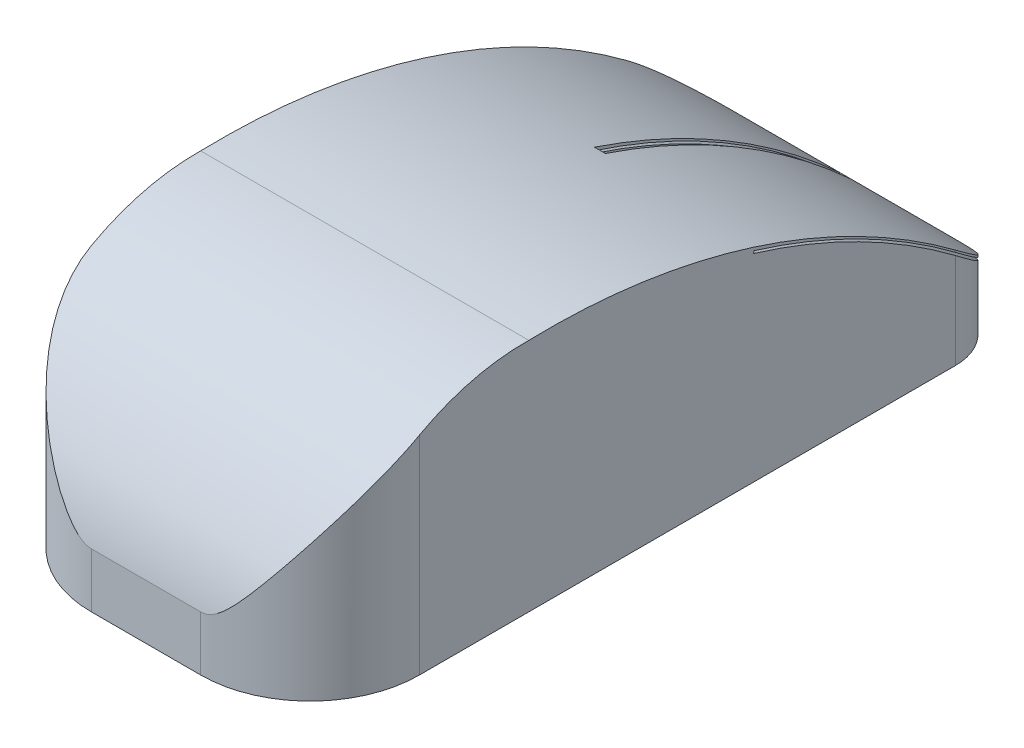
from build123d import *

# Parameters (mm, degrees)
BOSS_EXTRUDE1_DEPTH          = 10
BOSS_EXTRUDE2_DEPTH          = 60
SKETCH1_2_OUTSIDE_W          = 91.554
SKETCH1_2_OUTSIDE_H          = 159.554
CUT_EXTRUDE1_DEPTH           = 60
CUT_EXTRUDE_THIN1_DEPTH      = 148.772850252
CUT_EXTRUDE_THIN1_DEPTH_BACK = 60
SKETCH5_W                    = 2
SKETCH5_H                    = 33
CUT_EXTRUDE2_DEPTH           = 45


with BuildPart() as part:
    # Sketch1 → Boss-Extrude1 (new body)
    with BuildSketch(Plane(origin=(0, 0, 0), x_dir=(1, 0, 0), z_dir=(0, 1, 0))):
        with BuildLine():
            Line((0, 20), (0, 118))
            ThreePointArc((0, 118), (2.928932188, 125.071067812), (10, 128))
            Line((10, 128), (50, 128))
            ThreePointArc((50, 128), (57.071067812, 125.071067812), (60, 118))
            Line((60, 118), (60, 20))
            ThreePointArc((60, 20), (54.142135624, 5.857864376), (40, 0))
            Line((40, 0), (20, 0))
            ThreePointArc((20, 0), (5.857864376, 5.857864376), (0, 20))
        make_face()
    extrude(amount=BOSS_EXTRUDE1_DEPTH)

    # Sketch2 → Boss-Extrude2 (add)
    with BuildSketch(Plane(origin=(0, 0, 0), x_dir=(0, 0, -1), z_dir=(1, 0, 0))):
        with BuildLine():
            Line((0, 10), (128, 10))
            ThreePointArc((128, 10), (87.219557783, 35.085487422), (40, 43))
            ThreePointArc((40, 43), (13.928263114, 33.859681074), (0, 10))
        make_face()
    extrude(amount=BOSS_EXTRUDE2_DEPTH)

    # Sketch1<2> outside → Cut-Extrude1 (cut)
    with BuildSketch(Plane(origin=(0, 0, 0), x_dir=(1, 0, 0), z_dir=(0, 1, 0))):
        with Locations((30, 64)):
            Rectangle(SKETCH1_2_OUTSIDE_W, SKETCH1_2_OUTSIDE_H)
        with BuildLine():
            Line((0, 20), (0, 118))
            ThreePointArc((0, 118), (2.928932188, 125.071067812), (10, 128))
            Line((10, 128), (50, 128))
            ThreePointArc((50, 128), (57.071067812, 125.071067812), (60, 118))
            Line((60, 118), (60, 20))
            ThreePointArc((60, 20), (54.142135624, 5.857864376), (40, 0))
            Line((40, 0), (20, 0))
            ThreePointArc((20, 0), (5.857864376, 5.857864376), (0, 20))
        make_face(mode=Mode.SUBTRACT)
    extrude(amount=CUT_EXTRUDE1_DEPTH, mode=Mode.SUBTRACT)

    # Sketch4 → Cut-Extrude-Thin1 (cut, two sides: drawn at the far end of the back side and taken through both)
    with BuildSketch(Plane.ZY.offset(-CUT_EXTRUDE_THIN1_DEPTH_BACK)):
        with BuildLine():
            ThreePointArc((-81.07900099, 36.207870964), (-106.107453338, 25.30792926), (-128, 9))
            Line((-128, 9), (-128.274111127, 9.291312701))
            ThreePointArc((-128.274111127, 9.291312701), (-106.308105761, 25.653961926), (-81.195672425, 36.590477519))
            Line((-81.195672425, 36.590477519), (-81.07900099, 36.207870964))
        make_face()
    extrude(amount=CUT_EXTRUDE_THIN1_DEPTH + CUT_EXTRUDE_THIN1_DEPTH_BACK, mode=Mode.SUBTRACT)

    # Sketch5 → Cut-Extrude2 (cut)
    with BuildSketch(Plane(origin=(0, 0, -128), x_dir=(-1, 0, 0), z_dir=(0, 0, -1))):
        with Locations((-30, 26.5)):
            Rectangle(SKETCH5_W, SKETCH5_H)
    extrude(amount=-CUT_EXTRUDE2_DEPTH, mode=Mode.SUBTRACT)


solid = part.part
